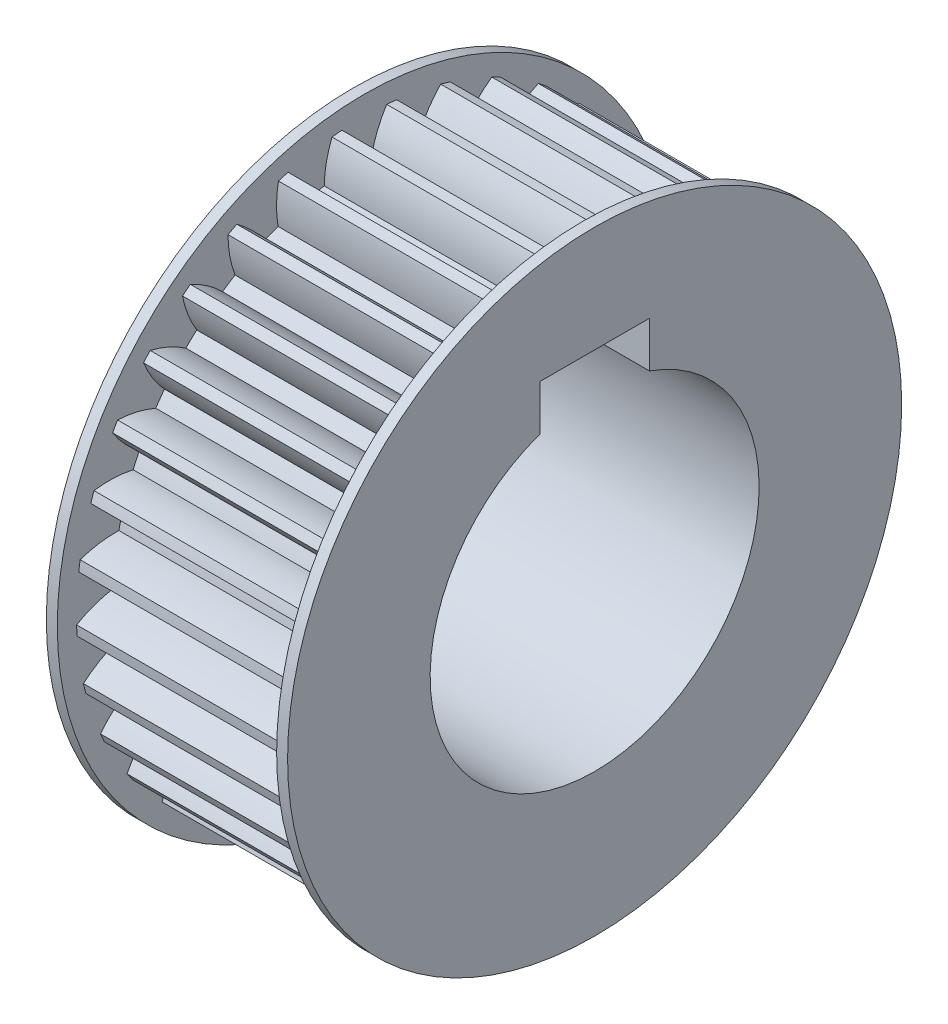
from build123d import *

# Parameters (mm, degrees)
BASPROSKE_W     = 20
BASPROSKE_H     = 26.25
TOOTHCUT_DEPTH  = 43.167819484
TEETHCUTS_COUNT = 33
TEETHCUTS_ANGLE = 349.090909091
BORSKE_R        = 15
BORE_DEPTH      = 50.0000508
KEYSKE_W        = 10
KEYSKE_H        = 18.3
KEYWAY_DEPTH    = 50.0000508
EXTRUDE_START   = 1
SKETCH_1_R      = 28
EXTRUDE_2_DEPTH = 1
SKETCH_2_R      = 28
EXTRUDE_3_DEPTH = 1


with BuildPart() as part:
    # BasProSke → Base-Revolve (revolve)
    with BuildSketch(Plane(origin=(0, 0, 0), x_dir=(1, 0, 0), z_dir=(0, 1, 0)), mode=Mode.PRIVATE) as base_revolve_sk:
        with Locations((10, 13.125)):
            Rectangle(BASPROSKE_W, BASPROSKE_H)
    revolve(base_revolve_sk.sketch.rotate(Axis((-10, 0, 0), (1, 0, 0)), 180), axis=Axis((-10, 0, 0), (1, 0, 0)))

    # TooCutSke → ToothCut (cut, through all)
    with BuildSketch(Plane(origin=(0, 0, 0), x_dir=(0, 0, -1), z_dir=(1, 0, 0))):
        with BuildLine():
            ThreePointArc((0.683690741, 22.863780155), (0, 22.874), (-0.683690741, 22.863780155))
            ThreePointArc((-0.683690741, 22.863780155), (-1.217783987, 24.592276227), (-2.057504394, 26.194719331))
            ThreePointArc((-2.057504394, 26.194719331), (0, 26.2754), (2.057504394, 26.194719331))
            ThreePointArc((2.057504394, 26.194719331), (1.217783987, 24.592276227), (0.683690741, 22.863780155))
        make_face()
    toothcut = extrude(amount=TOOTHCUT_DEPTH, mode=Mode.SUBTRACT)

    # TeethCuts: ToothCut ×33 about axis
    teethcuts_axis = Axis((-10, 0, 0), (1, 0, 0))
    for i in range(1, TEETHCUTS_COUNT):
        add(toothcut.rotate(teethcuts_axis, i * TEETHCUTS_ANGLE / (TEETHCUTS_COUNT - 1)), mode=Mode.SUBTRACT)

    # BorSke → Bore (cut, symmetric)
    with BuildSketch(Plane(origin=(0, 0, 0), x_dir=(0, 0, -1), z_dir=(1, 0, 0))):
        with Locations(Location((0, 0, 0), (0, 0, 180))):
            Circle(BORSKE_R)
    extrude(amount=BORE_DEPTH, both=True, mode=Mode.SUBTRACT)

    # KeySke → Keyway (cut, symmetric)
    with BuildSketch(Plane(origin=(0, 0, 0), x_dir=(0, 0, -1), z_dir=(1, 0, 0))):
        with Locations((0, 9.15)):
            Rectangle(KEYSKE_W, KEYSKE_H)
    extrude(amount=KEYWAY_DEPTH, both=True, mode=Mode.SUBTRACT)

    # Эскиз1 → Бобышка-Вытянуть2 (add)
    with BuildSketch(Plane(origin=(20, 0, 0), x_dir=(0, 0, -1), z_dir=(1, 0, 0)).offset(EXTRUDE_START)):
        Circle(SKETCH_1_R)
        with BuildLine():
            Line((5, 18.3), (-5, 18.3))
            Line((-5, 18.3), (-5, 14.142135624))
            ThreePointArc((-5, 14.142135624), (0, -15), (5, 14.142135624))
            Line((5, 14.142135624), (5, 18.3))
        make_face(mode=Mode.SUBTRACT)
    extrude(amount=-EXTRUDE_2_DEPTH)

    # Эскиз2 → Бобышка-Вытянуть3 (add)
    with BuildSketch(Plane.ZY):
        with Locations(Location((0, 0, 0), (0, 0, 180))):
            Circle(SKETCH_2_R)
        with BuildLine():
            Line((-5, 18.3), (-5, 14.142135624))
            ThreePointArc((-5, 14.142135624), (0, -15), (5, 14.142135624))
            Line((5, 14.142135624), (5, 18.3))
            Line((5, 18.3), (-5, 18.3))
        make_face(mode=Mode.SUBTRACT)
    extrude(amount=EXTRUDE_3_DEPTH)


solid = part.part
